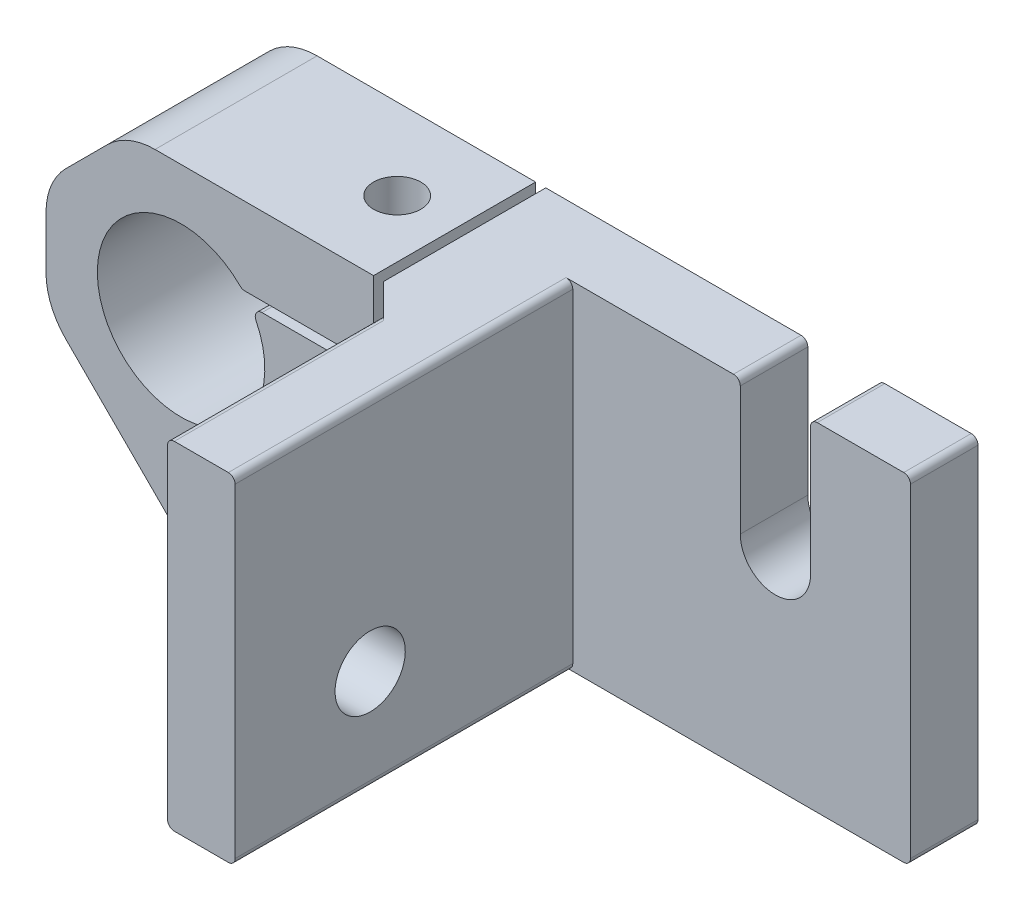
from build123d import *

# Parameters (mm, degrees)
BOSS_EXTRUDE1_DEPTH = 12
SKETCH3_W           = 25
SKETCH3_H           = 25
CUT_EXTRUDE1_DEPTH  = 7
SKETCH4_W           = 18
SKETCH4_H           = 25
SKETCH4_R           = 2.6
BOSS_EXTRUDE2_DEPTH = 5
CHAMFER1_SIZE       = 2
CUT_EXTRUDE2_DEPTH  = 5
FILLET1_R           = 5
FILLET2_R           = 0.5


with BuildPart() as part:
    # Sketch1 → Boss-Extrude1 (new body)
    with BuildSketch(Plane.XY):
        with BuildLine():
            Line((-22.5, 12.5), (-28.5, 6.5))
            Line((-28.5, 6.5), (-28.5, -1.5))
            Line((-28.5, -1.5), (-17.5, -12.5))
            Line((-17.5, -12.5), (28.5, -12.5))
            Line((28.5, -12.5), (28.5, 12.5))
            Line((28.5, 12.5), (-3.5, 12.5))
            Line((-3.5, 12.5), (-3.5, 6))
            Line((-3.5, 6), (-13.382383367, 6))
            ThreePointArc((-13.382383367, 6), (-23.330458604, -1.386729946), (-13.985855563, 6.75))
            Line((-13.985855563, 6.75), (-4.25, 6.75))
            Line((-4.25, 6.75), (-4.25, 12.5))
            Line((-4.25, 12.5), (-5.7, 12.5))
            Line((-5.7, 12.5), (-22.5, 12.5))
        make_face()
    extrude(amount=BOSS_EXTRUDE1_DEPTH)

    # Sketch3 → Cut-Extrude1 (cut)
    with BuildSketch(Plane.XY.offset(12)):
        with Locations((16, 0)):
            Rectangle(SKETCH3_W, SKETCH3_H)
    extrude(amount=-CUT_EXTRUDE1_DEPTH, mode=Mode.SUBTRACT)

    # Sketch4 → Boss-Extrude2 (add)
    with BuildSketch(Plane(origin=(3.5, 0, 0), x_dir=(0, 0, -1), z_dir=(1, 0, 0))):
        with Locations((-21, 0)):
            Rectangle(SKETCH4_W, SKETCH4_H)
        with Locations(Location((-20, -5, 0), (0, 0, 90))):
            Circle(SKETCH4_R, mode=Mode.SUBTRACT)
    extrude(amount=-BOSS_EXTRUDE2_DEPTH)

    # Chamfer1
    chamfer1_edges = [part.edges().sort_by_distance(p)[0] for p in [
        (-1.5, 0, 12),
    ]]
    chamfer(chamfer1_edges, length=CHAMFER1_SIZE)

    # Sketch5 → Cut-Extrude2 (cut)
    with BuildSketch(Plane.XY.offset(5)):
        with BuildLine():
            Line((15.9, 2.5), (15.9, 12.5))
            Line((15.9, 12.5), (21.1, 12.5))
            Line((21.1, 12.5), (21.1, 2.5))
            ThreePointArc((21.1, 2.5), (18.5, -0.1), (15.9, 2.5))
        make_face()
    extrude(amount=-CUT_EXTRUDE2_DEPTH, mode=Mode.SUBTRACT)

    # Fillet1
    fillet1_edges = [part.edges().sort_by_distance(p)[0] for p in [
        (-17.5, -12.5, 6),
        (-28.5, -1.5, 6),
        (-28.5, 6.5, 6),
        (-22.5, 12.5, 6),
    ]]
    fillet(fillet1_edges, radius=FILLET1_R)

    # Fillet2
    fillet2_edges = [part.edges().sort_by_distance(p)[0] for p in [
        (-13.985855563, 6.75, 6),
        (-13.382383367, 6, 6),
        (28.5, 12.5, 2.5),
        (28.5, -12.5, 2.5),
        (3.5, -12.5, 17.5),
        (3.5, 12.5, 17.5),
        (-1.5, -12.5, 22),
        (-1.5, 12.5, 22),
        (15.9, 12.5, 2.5),
        (21.1, 12.5, 2.5),
    ]]
    fillet(fillet2_edges, radius=FILLET2_R)

    # Sketch6 → Cut-Revolve1 (revolve, cut)
    with BuildSketch(Plane(origin=(0, 0, 6), x_dir=(-1, 0, 0), z_dir=(0, 0, -1)), mode=Mode.PRIVATE) as cut_revolve1_sk:
        Polygon((8.5, 12.5), (10.25, 12.5), (10.25, -7.5), (10.85, -7.5), (10.85, -12), (11, -12), (11, -12.5), (8.5, -12.5), align=None)
    revolve(cut_revolve1_sk.sketch.rotate(Axis((-8.5, 12.5, 6), (0, -1, 0)), 270), axis=Axis((-8.5, 12.5, 6), (0, -1, 0)), mode=Mode.SUBTRACT)


solid = part.part
